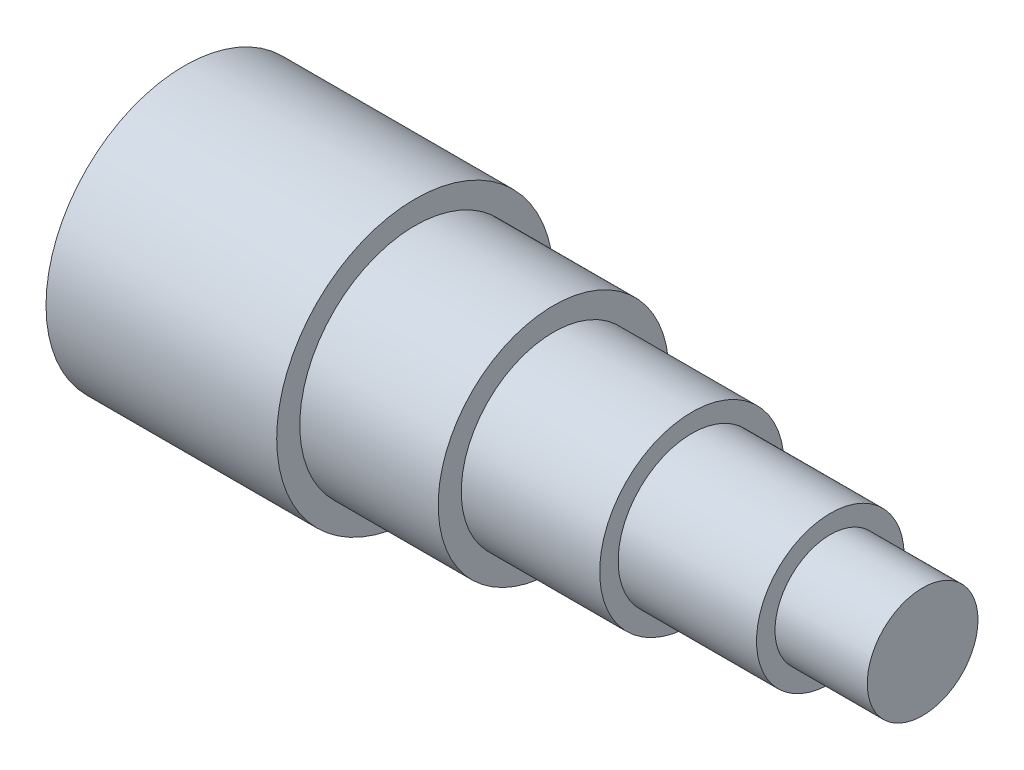
from build123d import *

# Parameters (mm, degrees)
SKETCH1_R           = 15
BOSS_EXTRUDE1_DEPTH = 80
CUT_EXTRUDE1_START  = -55
SKETCH2_R           = 15
SKETCH2_R_2         = 12.5
CUT_EXTRUDE1_DEPTH  = 55
CUT_EXTRUDE2_START  = -40
SKETCH3_R           = 12.5
SKETCH3_R_2         = 10
CUT_EXTRUDE2_DEPTH  = 40
CUT_EXTRUDE3_START  = -25
SKETCH4_R           = 10
SKETCH4_R_2         = 8
CUT_EXTRUDE3_DEPTH  = 25
CUT_EXTRUDE4_START  = -10
SKETCH5_R           = 8
SKETCH5_R_2         = 6
CUT_EXTRUDE4_DEPTH  = 10


with BuildPart() as part:
    # Sketch1 → Boss-Extrude1 (new body)
    with BuildSketch(Plane(origin=(0, 0, 0), x_dir=(0, 0, -1), z_dir=(1, 0, 0))):
        Circle(SKETCH1_R)
    extrude(amount=BOSS_EXTRUDE1_DEPTH)

    # Sketch2 → Cut-Extrude1 (cut)
    with BuildSketch(Plane(origin=(80, 0, 0), x_dir=(0, 0, -1), z_dir=(1, 0, 0)).offset(CUT_EXTRUDE1_START)):
        Circle(SKETCH2_R)
        Circle(SKETCH2_R_2, mode=Mode.SUBTRACT)
    extrude(amount=CUT_EXTRUDE1_DEPTH, mode=Mode.SUBTRACT)

    # Sketch3 → Cut-Extrude2 (cut)
    with BuildSketch(Plane(origin=(80, 0, 0), x_dir=(0, 0, -1), z_dir=(1, 0, 0)).offset(CUT_EXTRUDE2_START)):
        Circle(SKETCH3_R)
        Circle(SKETCH3_R_2, mode=Mode.SUBTRACT)
    extrude(amount=CUT_EXTRUDE2_DEPTH, mode=Mode.SUBTRACT)

    # Sketch4 → Cut-Extrude3 (cut)
    with BuildSketch(Plane(origin=(80, 0, 0), x_dir=(0, 0, -1), z_dir=(1, 0, 0)).offset(CUT_EXTRUDE3_START)):
        Circle(SKETCH4_R)
        Circle(SKETCH4_R_2, mode=Mode.SUBTRACT)
    extrude(amount=CUT_EXTRUDE3_DEPTH, mode=Mode.SUBTRACT)

    # Sketch5 → Cut-Extrude4 (cut)
    with BuildSketch(Plane(origin=(80, 0, 0), x_dir=(0, 0, -1), z_dir=(1, 0, 0)).offset(CUT_EXTRUDE4_START)):
        Circle(SKETCH5_R)
        Circle(SKETCH5_R_2, mode=Mode.SUBTRACT)
    extrude(amount=CUT_EXTRUDE4_DEPTH, mode=Mode.SUBTRACT)


solid = part.part
